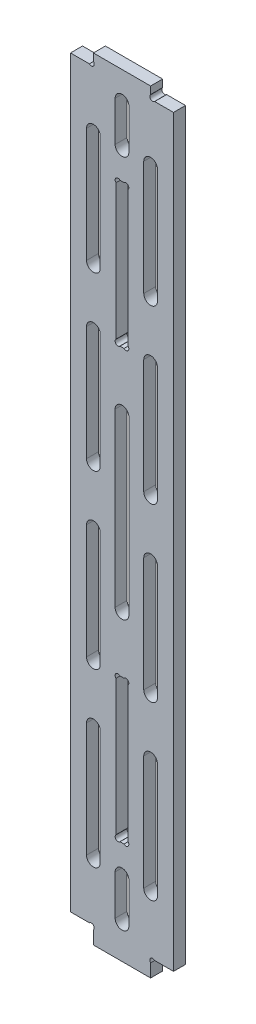
from build123d import *

# Parameters (mm, degrees)
SKETCH_1_W          = 18
SKETCH_1_H          = 130
SKETCH_1_W_2        = 5
SKETCH_1_H_2        = 2
SKETCH_1_H_3        = 3
EXTRUDE_1_DEPTH     = 1.05
SKETCH_5_R          = 0.5
CUT_EXTRUDE_3_DEPTH = 69.625141166
SKETCH_2_W          = 1.05
SKETCH_2_H          = 25.1
CUT_EXTRUDE_1_DEPTH = 10
SKETCH_6_R          = 0.5
CUT_EXTRUDE_4_DEPTH = 69.625141166
CUT_EXTRUDE_5_DEPTH = 69.625141166
CUT_EXTRUDE_6_DEPTH = 69.625141166


with BuildPart() as part:
    # 草图1 → 凸台-拉伸1 (new, symmetric)
    with BuildSketch(Plane.XY):
        Rectangle(SKETCH_1_W, SKETCH_1_H)
        with Locations((-2.5, 66)):
            Rectangle(SKETCH_1_W_2, SKETCH_1_H_2)
        with Locations((2.5, 66)):
            Rectangle(SKETCH_1_W_2, SKETCH_1_H_2)
        with Locations((2.5, -66.5)):
            Rectangle(SKETCH_1_W_2, SKETCH_1_H_3)
        with Locations((-2.5, -66.5)):
            Rectangle(SKETCH_1_W_2, SKETCH_1_H_3)
    extrude(amount=EXTRUDE_1_DEPTH, both=True)

    # 草图5 → 切除-拉伸3 (cut, through all)
    with BuildSketch(Plane.XY.offset(1.05)):
        with Locations((5.353553391, 65.353553391)):
            Circle(SKETCH_5_R)
        with Locations((-5.353553391, 65.353553391)):
            Circle(SKETCH_5_R)
        with Locations((5.353553391, -65.353553391)):
            Circle(SKETCH_5_R)
        with Locations((-5.353553391, -65.353553391)):
            Circle(SKETCH_5_R)
    extrude(amount=-CUT_EXTRUDE_3_DEPTH, mode=Mode.SUBTRACT)

    # 草图2 → 切除-拉伸1 (cut)
    with BuildSketch(Plane.XY.offset(1.05)):
        with Locations((0.525, 37.5)):
            Rectangle(SKETCH_2_W, SKETCH_2_H)
        with Locations((-0.525, 37.5)):
            Rectangle(SKETCH_2_W, SKETCH_2_H)
        with Locations((0.525, -37.5)):
            Rectangle(SKETCH_2_W, SKETCH_2_H)
        with Locations((-0.525, -37.5)):
            Rectangle(SKETCH_2_W, SKETCH_2_H)
    extrude(amount=-CUT_EXTRUDE_1_DEPTH, mode=Mode.SUBTRACT)

    # 草图6 → 切除-拉伸4 (cut, through all)
    with BuildSketch(Plane.XY.offset(1.05)):
        with Locations((0.696446609, 49.696446609)):
            Circle(SKETCH_6_R)
        with Locations((-0.696446609, 49.696446609)):
            Circle(SKETCH_6_R)
        with Locations((0.696446609, 25.303553391)):
            Circle(SKETCH_6_R)
        with Locations((-0.696446609, 25.303553391)):
            Circle(SKETCH_6_R)
    cut_extrude_4 = extrude(amount=-CUT_EXTRUDE_4_DEPTH, mode=Mode.SUBTRACT)

    # 镜向1: 切除-拉伸4 across plane
    add(cut_extrude_4.mirror(Plane.ZX), mode=Mode.SUBTRACT)

    # 草图4 → 切除-拉伸5 (cut, through all)
    with BuildSketch(Plane.XY.offset(1.05)):
        with BuildLine():
            Line((6.2, 55), (6.2, 35))
            ThreePointArc((6.2, 35), (5, 33.8), (3.8, 35))
            Line((3.8, 35), (3.8, 55))
            ThreePointArc((3.8, 55), (5, 56.2), (6.2, 55))
        make_face()
        with BuildLine():
            Line((6.2, 25), (6.2, 5))
            ThreePointArc((6.2, 5), (5, 3.8), (3.8, 5))
            Line((3.8, 5), (3.8, 25))
            ThreePointArc((3.8, 25), (5, 26.2), (6.2, 25))
        make_face()
        with BuildLine():
            Line((6.2, -5), (6.2, -25))
            ThreePointArc((6.2, -25), (5, -26.2), (3.8, -25))
            Line((3.8, -25), (3.8, -5))
            ThreePointArc((3.8, -5), (5, -3.8), (6.2, -5))
        make_face()
        with BuildLine():
            Line((3.8, -55), (3.8, -35))
            ThreePointArc((3.8, -35), (5, -33.8), (6.2, -35))
            Line((6.2, -35), (6.2, -55))
            ThreePointArc((6.2, -55), (5, -56.2), (3.8, -55))
        make_face()
    cut_extrude_5 = extrude(amount=-CUT_EXTRUDE_5_DEPTH, mode=Mode.SUBTRACT)

    # 镜向2: 切除-拉伸5 across plane
    add(cut_extrude_5.mirror(Plane(origin=(0, 0, 0), x_dir=(0, 0, 1), z_dir=(1, 0, 0))), mode=Mode.SUBTRACT)

    # 草图7 → 切除-拉伸6 (cut, through all)
    with BuildSketch(Plane.XY.offset(1.05)):
        with BuildLine():
            Line((1.2, 62.05), (1.2, 55.05))
            ThreePointArc((1.2, 55.05), (0, 53.85), (-1.2, 55.05))
            Line((-1.2, 55.05), (-1.2, 62.05))
            ThreePointArc((-1.2, 62.05), (0, 63.25), (1.2, 62.05))
        make_face()
        with BuildLine():
            Line((1.2, 15), (1.2, -15))
            ThreePointArc((1.2, -15), (0, -16.2), (-1.2, -15))
            Line((-1.2, -15), (-1.2, 15))
            ThreePointArc((-1.2, 15), (0, 16.2), (1.2, 15))
        make_face()
        with BuildLine():
            Line((1.2, -55.05), (1.2, -62.05))
            ThreePointArc((1.2, -62.05), (0, -63.25), (-1.2, -62.05))
            Line((-1.2, -62.05), (-1.2, -55.05))
            ThreePointArc((-1.2, -55.05), (0, -53.85), (1.2, -55.05))
        make_face()
    extrude(amount=-CUT_EXTRUDE_6_DEPTH, mode=Mode.SUBTRACT)


solid = part.part
